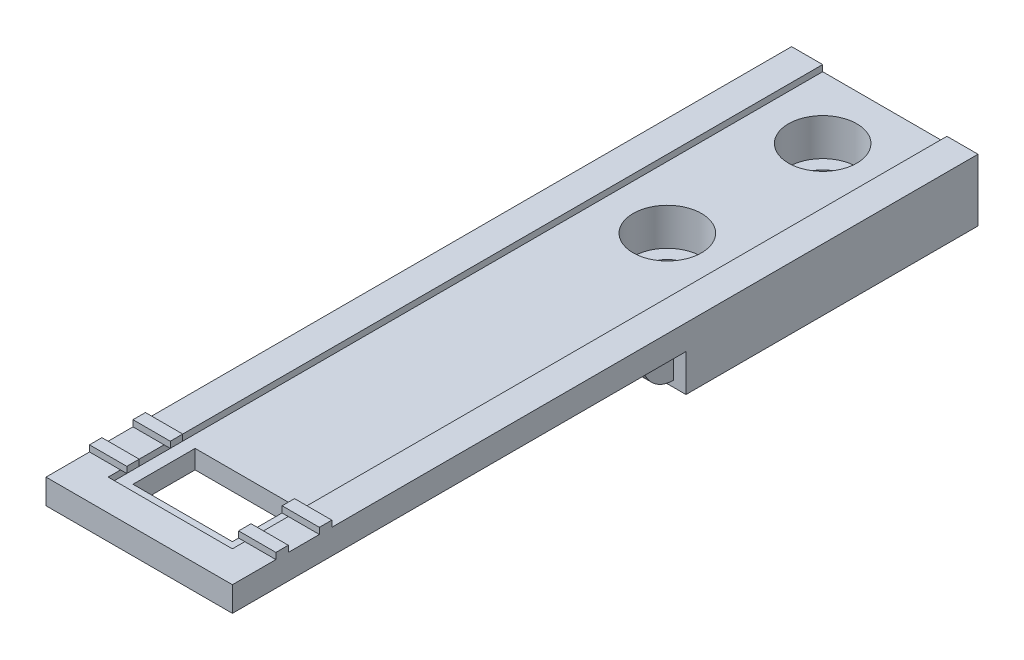
from build123d import *

# Parameters (mm, degrees)
SKETCH1_W                                     = 30
SKETCH1_H                                     = 120
BOSS_EXTRUDE1_DEPTH                           = 9
BOSS_EXTRUDE2_DEPTH                           = 1
CBORE_FOR_M6_HEX_SOCKET_HEAD_CAP1_D           = 6.6
CBORE_FOR_M6_HEX_SOCKET_HEAD_CAP1_CBORE_D     = 11
CBORE_FOR_M6_HEX_SOCKET_HEAD_CAP1_CBORE_DEPTH = 6
SKETCH17_W                                    = 6
SKETCH17_H                                    = 2
BOSS_EXTRUDE3_DEPTH                           = 1
CUT_EXTRUDE11_DEPTH                           = 120.609404064
CUT_EXTRUDE11_DEPTH_BACK                      = 120.609404064
SKETCH18_W                                    = 16
SKETCH18_H                                    = 10
SKETCH19_W                                    = 30
SKETCH19_H                                    = 73
CUT_EXTRUDE12_DEPTH                           = 6
SKETCH20_W                                    = 2
SKETCH20_H                                    = 5
REVOLVE2_ANGLE                                = 90


with BuildPart() as part:
    # Sketch1 → Boss-Extrude1 (new body)
    with BuildSketch(Plane(origin=(0, 0, 0), x_dir=(1, 0, 0), z_dir=(0, 1, 0))):
        with Locations((2.137715261, -58.032657583)):
            Rectangle(SKETCH1_W, SKETCH1_H)
    extrude(amount=BOSS_EXTRUDE1_DEPTH)

    # Sketch2 → Boss-Extrude2 (add)
    with BuildSketch(Plane(origin=(0, 9, 0), x_dir=(1, 0, 0), z_dir=(0, 1, 0))):
        Polygon((-12.862284739, -118.032657583), (17.137715261, -118.032657583), (17.137715261, -68.032657583), (17.137715261, 1.967342417), (12.137715261, 1.967342417), (12.137715261, -113.032657583), (-7.862284739, -113.032657583), (-7.862284739, 1.967342417), (-12.862284739, 1.967342417), (-12.862284739, -73.032657583), align=None)
    extrude(amount=BOSS_EXTRUDE2_DEPTH)

    # CBORE for M6 Hex Socket Head Cap1 (through all)
    with Locations(Plane(origin=(0, 9, 0), x_dir=(1, 0, 0), z_dir=(0, 1, 0))):
        with Locations((2.137715261, -8.032657583), (2.137715261, -33.032657583)):
            CounterBoreHole(CBORE_FOR_M6_HEX_SOCKET_HEAD_CAP1_D / 2, CBORE_FOR_M6_HEX_SOCKET_HEAD_CAP1_CBORE_D / 2, CBORE_FOR_M6_HEX_SOCKET_HEAD_CAP1_CBORE_DEPTH)

    # Sketch17 → Boss-Extrude3 (add)
    with BuildSketch(Plane(origin=(0, 10, 0), x_dir=(1, 0, 0), z_dir=(0, 1, 0))):
        with Locations((14.137715261, -110.032657583)):
            Rectangle(SKETCH17_W, SKETCH17_H)
        with Locations((-9.862284739, -110.032657583)):
            Rectangle(SKETCH17_W, SKETCH17_H)
        with Locations((14.137715261, -103.032657583)):
            Rectangle(SKETCH17_W, SKETCH17_H)
        with Locations((-9.862284739, -103.032657583)):
            Rectangle(SKETCH17_W, SKETCH17_H)
    extrude(amount=BOSS_EXTRUDE3_DEPTH)

    # Sketch18 → Cut-Extrude11 (cut, two sides: drawn at the far end of the back side and taken through both)
    with BuildSketch(Plane(origin=(0, 9, 0), x_dir=(1, 0, 0), z_dir=(0, 1, 0)).offset(-CUT_EXTRUDE11_DEPTH_BACK)):
        with Locations((2.137715261, -106.032657583)):
            Rectangle(SKETCH18_W, SKETCH18_H)
    extrude(amount=CUT_EXTRUDE11_DEPTH + CUT_EXTRUDE11_DEPTH_BACK, mode=Mode.SUBTRACT)

    # Sketch19 → Cut-Extrude12 (cut)
    with BuildSketch(Plane.XZ):
        with Locations((2.137715261, 81.532657583)):
            Rectangle(SKETCH19_W, SKETCH19_H)
    extrude(amount=-CUT_EXTRUDE12_DEPTH, mode=Mode.SUBTRACT)

    # Sketch20 → Revolve2 (revolve)
    with BuildSketch(Plane.XZ.offset(-6)):
        with Locations((-9.862284739, 47.532657583)):
            Rectangle(SKETCH20_W, SKETCH20_H)
        with Locations((14.137715261, 47.532657583)):
            Rectangle(SKETCH20_W, SKETCH20_H)
    revolve(axis=Axis((17.137715261, 6, 45.032657583), (1, 0, 0)), revolution_arc=REVOLVE2_ANGLE)


solid = part.part
